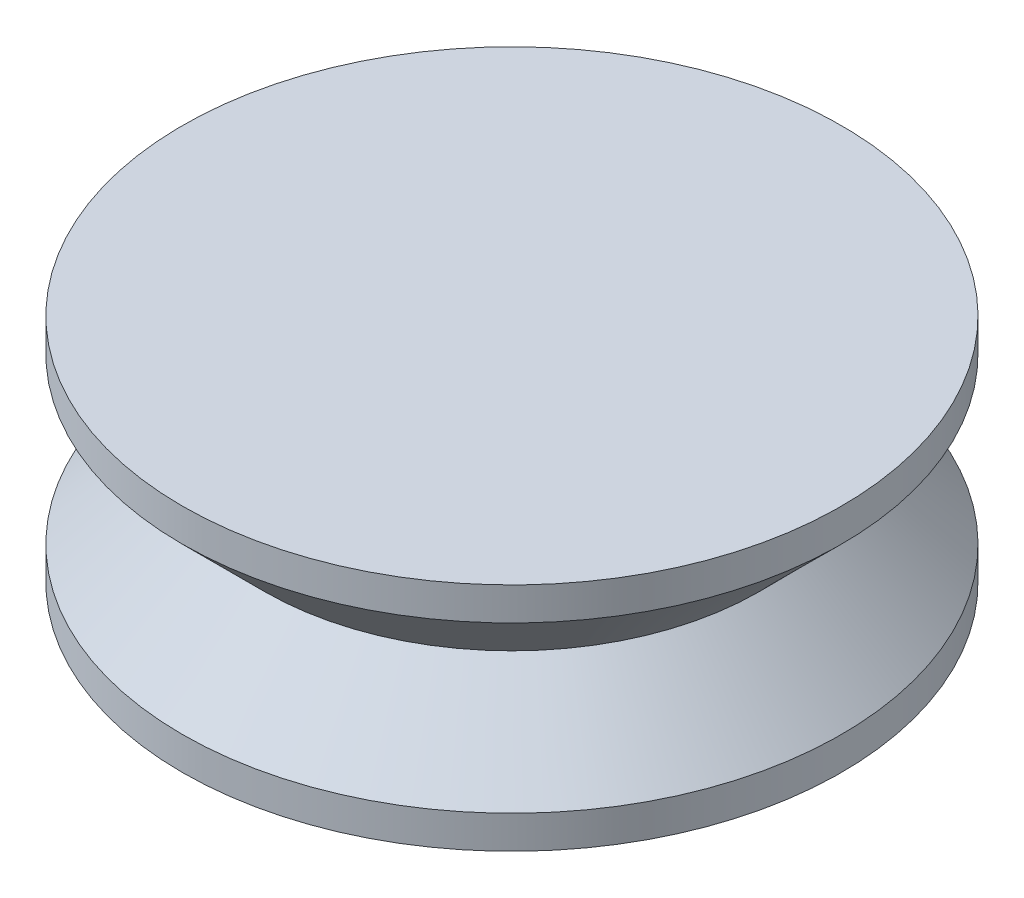
from build123d import *


with BuildPart() as part:
    # Sketch2 → Revolve1 (revolve)
    with BuildSketch(Plane.XY, mode=Mode.PRIVATE) as revolve1_sk:
        Polygon((0, 4.445), (0, -4.445), (12.7, -4.445), (12.7, -3.175), (9.525, 0), (12.7, 3.175), (12.7, 4.445), align=None)
    revolve(revolve1_sk.sketch.rotate(Axis((0, 4.445, 0), (0, -1, 0)), 90), axis=Axis((0, 4.445, 0), (0, -1, 0)))


solid = part.part
